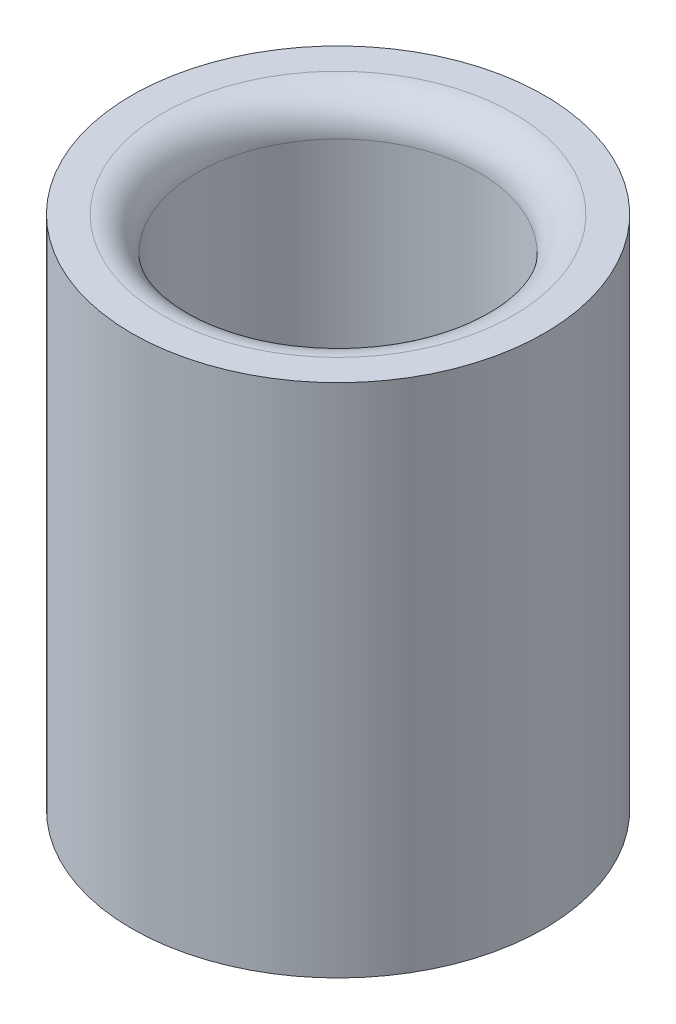
from build123d import *

# Parameters (mm, degrees)
CROQUIS1_R              = 6
SALIENTE_EXTRUIR1_DEPTH = 15
CROQUIS2_R              = 4.1
CORTAR_EXTRUIR1_DEPTH   = 9
REDONDEO1_R             = 1


with BuildPart() as part:
    # Croquis1 → Saliente-Extruir1 (new body)
    with BuildSketch(Plane(origin=(0, 0, 0), x_dir=(1, 0, 0), z_dir=(0, 1, 0))):
        with Locations(Location((0, 0, 0), (0, 0, 270))):
            Circle(CROQUIS1_R)
    extrude(amount=SALIENTE_EXTRUIR1_DEPTH)

    # Croquis2 → Cortar-Extruir1 (cut)
    with BuildSketch(Plane(origin=(0, 15, 0), x_dir=(1, 0, 0), z_dir=(0, 1, 0))):
        with Locations(Location((0, 0, 0), (0, 0, 270))):
            Circle(CROQUIS2_R)
    extrude(amount=-CORTAR_EXTRUIR1_DEPTH, mode=Mode.SUBTRACT)

    # Redondeo1
    redondeo1_edges = [part.edges().sort_by_distance(p)[0] for p in [
        (0, 15, -4.1),
    ]]
    fillet(redondeo1_edges, radius=REDONDEO1_R)


solid = part.part
